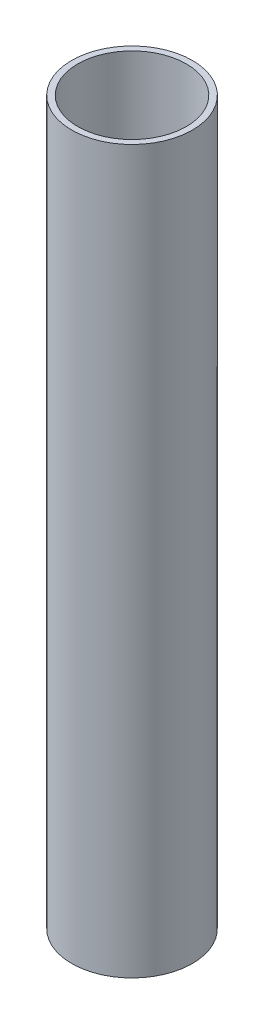
from build123d import *

# Parameters (mm, degrees)
SKETCH1_R           = 15
SKETCH1_R_2         = 13.5
BOSS_EXTRUDE1_DEPTH = 179.4


with BuildPart() as part:
    # Sketch1 → Boss-Extrude1 (new body)
    with BuildSketch(Plane(origin=(0, 0, 0), x_dir=(1, 0, 0), z_dir=(0, 1, 0))):
        with Locations(Location((0, 0, 0), (0, 0, 90))):
            Circle(SKETCH1_R)
        with Locations(Location((0, 0, 0), (0, 0, 90))):
            Circle(SKETCH1_R_2, mode=Mode.SUBTRACT)
    extrude(amount=BOSS_EXTRUDE1_DEPTH)


solid = part.part
